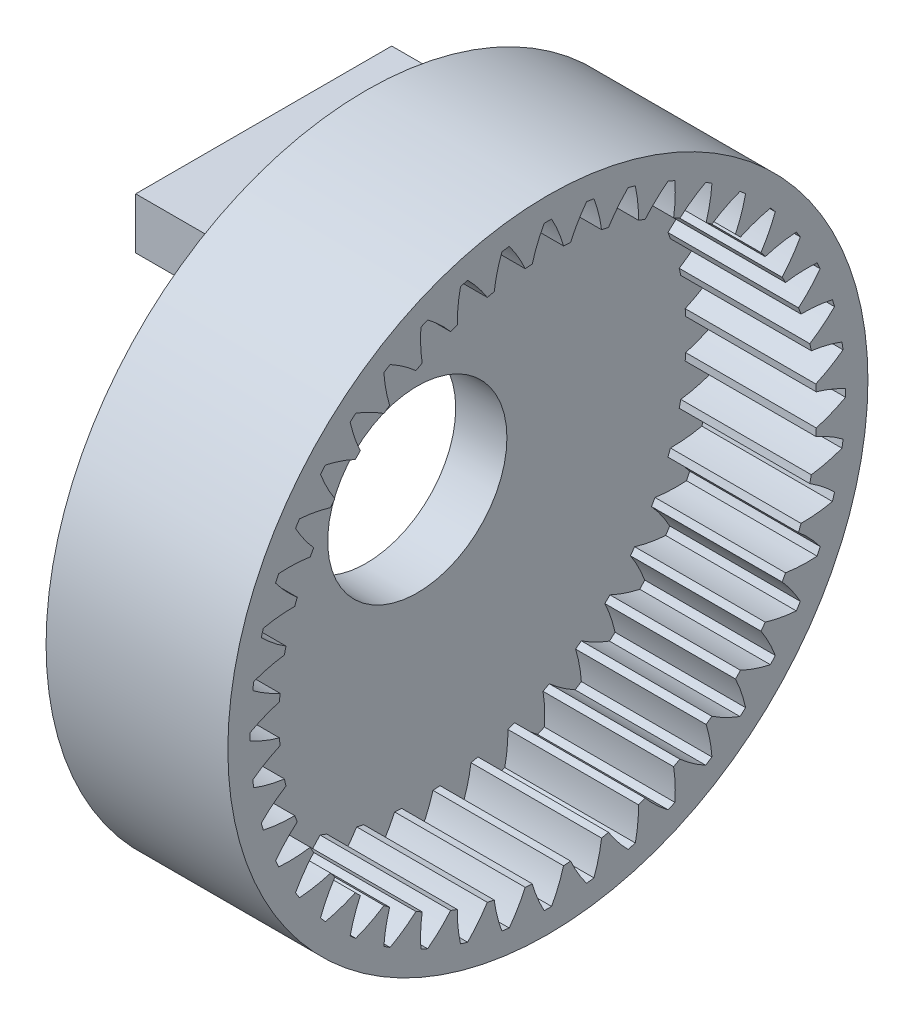
from build123d import *

# Parameters (mm, degrees)
BASPROSKE_W     = 5.1
BASPROSKE_H     = 2
TOOTHCUT_DEPTH  = 19.398641254
TEETHCUTS_COUNT = 44
TEETHCUTS_ANGLE = 351.818181818
SKETCH_1_R      = 12.5
SKETCH_1_R_2    = 3.5
EXTRUDE_1_DEPTH = 2
EXTRUDE_START   = -2
SKETCH_1_3_W    = 10
SKETCH_1_3_H    = 2
EXTRUDE_2_DEPTH = 4


with BuildPart() as part:
    # BasProSke → Base-Revolve (revolve)
    with BuildSketch(Plane(origin=(0, 0, 0), x_dir=(1, 0, 0), z_dir=(0, 1, 0)), mode=Mode.PRIVATE) as base_revolve_sk:
        with Locations((2.55, 11.5)):
            Rectangle(BASPROSKE_W, BASPROSKE_H)
    revolve(base_revolve_sk.sketch.rotate(Axis((-10, 0, 0), (1, 0, 0)), 180), axis=Axis((-10, 0, 0), (1, 0, 0)))

    # TooCutSke → ToothCut (cut, through all)
    with BuildSketch(Plane(origin=(0, 0, 0), x_dir=(0, 0, -1), z_dir=(1, 0, 0))):
        with BuildLine():
            ThreePointArc((0.617829312, 10.456363235), (0.415030024, 11.054321192), (0.145033431, 11.625095325))
            ThreePointArc((0.145033431, 11.625095325), (0, 11.626), (-0.145033431, 11.625095325))
            ThreePointArc((-0.145033431, 11.625095325), (-0.415030024, 11.054321192), (-0.617829312, 10.456363235))
            ThreePointArc((-0.617829312, 10.456363235), (0, 10.4746), (0.617829312, 10.456363235))
        make_face()
    toothcut = extrude(amount=TOOTHCUT_DEPTH, mode=Mode.SUBTRACT)

    # TeethCuts: ToothCut ×44 about axis
    teethcuts_axis = Axis((-10, 0, 0), (1, 0, 0))
    for i in range(1, TEETHCUTS_COUNT):
        add(toothcut.rotate(teethcuts_axis, i * TEETHCUTS_ANGLE / (TEETHCUTS_COUNT - 1)), mode=Mode.SUBTRACT)

    # 草图1 → 凸台-拉伸1 (add)
    with BuildSketch(Plane(origin=(0, 0, 0), x_dir=(0, 0, -1), z_dir=(1, 0, 0))):
        with Locations(Location((0, 0, 0), (0, 0, 180))):
            Circle(SKETCH_1_R)
        Circle(SKETCH_1_R_2, mode=Mode.SUBTRACT)
    extrude(amount=-EXTRUDE_1_DEPTH)

    # 草图1<3> → 凸台-拉伸2 (add)
    with BuildSketch(Plane(origin=(0, 0, 0), x_dir=(0, 0, -1), z_dir=(1, 0, 0)).offset(EXTRUDE_START)):
        with Locations((0, 8.5)):
            Rectangle(SKETCH_1_3_W, SKETCH_1_3_H)
        with Locations((0, -8.5)):
            Rectangle(SKETCH_1_3_W, SKETCH_1_3_H)
    extrude(amount=-EXTRUDE_2_DEPTH)


solid = part.part
